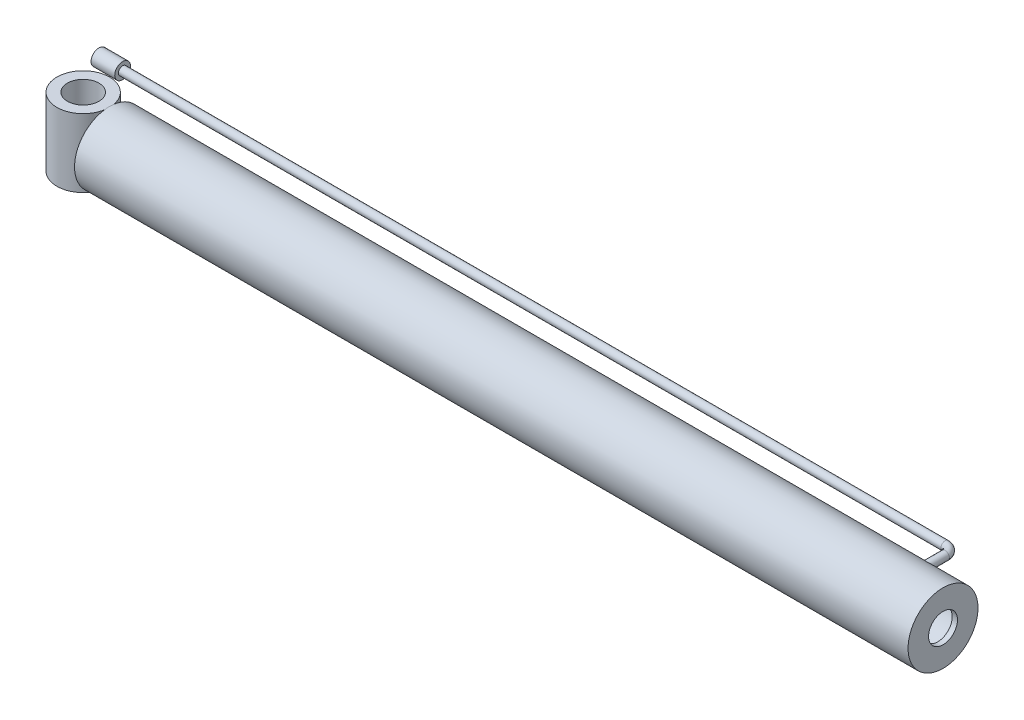
from build123d import *

# Parameters (mm, degrees)
SKETCH_1_W                   = 20
SKETCH_1_H                   = 130
EXTRUDE_1_REACH              = 131.325
SKETCH_2_R                   = 40
SKETCH_3_R                   = 66.5
EXTRUDE_2_DEPTH              = 25
SKETCH_4_R                   = 66.5
SKETCH_4_R_2                 = 55
EXTRUDE_3_DEPTH              = 1560
SKETCH_5_R                   = 66.5
SKETCH_5_R_2                 = 27.5
EXTRUDE_4_DEPTH              = 10
SKETCH_8_R                   = 8
SKETCH_8_R_2                 = 6
SKETCH_9_R                   = 8
SKETCH_9_R_2                 = 6
SKETCH_10_R                  = 15
EXTRUDE_5_DEPTH              = 45
HOLE_WIZARD_M18_1_AT_2_COUNT = 2
HOLE_WIZARD_M18_1_AT_2_PITCH = 86


with BuildPart() as part:
    # 草图1 → 旋转1 (revolve)
    with BuildSketch(Plane.XY, mode=Mode.PRIVATE) as revolve_1_sk:
        with Locations((40, 0)):
            Rectangle(SKETCH_1_W, SKETCH_1_H)
    revolve(revolve_1_sk.sketch.rotate(Axis((0, 0, 0), (0, 1, 0)), 90), axis=Axis((0, 0, 0), (0, 1, 0)))

    # 草图2 → 凸台-拉伸1 (add, up to next)
    with BuildSketch(Plane(origin=(50, 0, 0), x_dir=(0, 0, -1), z_dir=(1, 0, 0)), mode=Mode.PRIVATE) as extrude_1_sk1:
        Circle(SKETCH_2_R)
    extrude_1_tool1 = extrude(extrude_1_sk1.sketch, amount=-EXTRUDE_1_REACH, mode=Mode.PRIVATE) - part.part
    add(extrude_1_tool1.solids().sort_by_distance((50, 0, 0))[0])
    add(extrude_1_tool1.solids().sort_by_distance((50, 0, 0))[1])


with BuildPart() as body_2:
    # 草图3 → 凸台-拉伸2 (new body)
    with BuildSketch(Plane(origin=(75, 0, 0), x_dir=(0, 0, -1), z_dir=(1, 0, 0))):
        Circle(SKETCH_3_R)
    extrude(amount=-EXTRUDE_2_DEPTH)

    # 草图4 → 凸台-拉伸3 (add)
    with BuildSketch(Plane(origin=(75, 0, 0), x_dir=(0, 0, -1), z_dir=(1, 0, 0))):
        Circle(SKETCH_4_R)
        Circle(SKETCH_4_R_2, mode=Mode.SUBTRACT)
    extrude(amount=EXTRUDE_3_DEPTH)

    # 草图5 → 凸台-拉伸4 (add)
    with BuildSketch(Plane(origin=(1635, 0, 0), x_dir=(0, 0, -1), z_dir=(1, 0, 0))):
        Circle(SKETCH_5_R)
        Circle(SKETCH_5_R_2, mode=Mode.SUBTRACT)
    extrude(amount=-EXTRUDE_4_DEPTH)

    # 扫描1: sweep along a path in 草图7
    with BuildLine(Plane(origin=(0, -43, 0), x_dir=(1, 0, 0), z_dir=(0, 1, 0))) as sweep_1_path:
        Line((-65, 95), (69, 95))
        ThreePointArc((69, 95), (80.313708499, 90.313708499), (85, 79))
        Line((85, 79), (85, 18.616967425))
    # 草图8 → 扫描1 (sweep)
    with BuildSketch(Plane(origin=(-65, -43, -95), x_dir=(0, 0, -1), z_dir=(1, 0, 0))):
        Circle(SKETCH_8_R)
        Circle(SKETCH_8_R_2, mode=Mode.SUBTRACT)
    sweep(path=sweep_1_path.line)

    # 扫描2: sweep along a path in 草图6
    with BuildLine(Plane(origin=(0, 43, 0), x_dir=(1, 0, 0), z_dir=(0, 1, 0))) as sweep_2_path:
        Line((1560, 31.737202692), (1560, 79))
        ThreePointArc((1560, 79), (1555.313708499, 90.313708499), (1544, 95))
        Line((1544, 95), (-65, 95))
    # 草图9 → 扫描2 (sweep)
    with BuildSketch(Plane(origin=(-65, 43, -95), x_dir=(0, 0, 1), z_dir=(-1, 0, 0))):
        Circle(SKETCH_9_R)
        Circle(SKETCH_9_R_2, mode=Mode.SUBTRACT)
    sweep(path=sweep_2_path.line)

    # 草图10 → 凸台-拉伸5 (add)
    with BuildSketch(Plane.ZY.offset(65)):
        with Locations((-95, 43)):
            Circle(SKETCH_10_R)
        with Locations((-95, -43)):
            Circle(SKETCH_10_R)
    extrude(amount=-EXTRUDE_5_DEPTH)

    # 草图12 → M18 螺纹孔的螺纹孔钻头1 (revolve, cut)
    with BuildSketch(Plane(origin=(-65, -43, -95), x_dir=(0, 0, 1), z_dir=(0, 1, 0))):
        Polygon((0, 0), (0, 24.656669797), (7.75, 20), (7.75, 0), align=None)
    hole_wizard_m18_1 = revolve(axis=Axis((-71.35, -43, -95), (1, 0, 0)), mode=Mode.SUBTRACT)

    # M18 螺纹孔的螺纹孔钻头1 at 2: M18 螺纹孔的螺纹孔钻头1 ×2
    with Locations(*[(0, i * HOLE_WIZARD_M18_1_AT_2_PITCH, 0) for i in range(1, HOLE_WIZARD_M18_1_AT_2_COUNT)]):
        add(hole_wizard_m18_1, mode=Mode.SUBTRACT)


solid = Compound([part.part, body_2.part])
